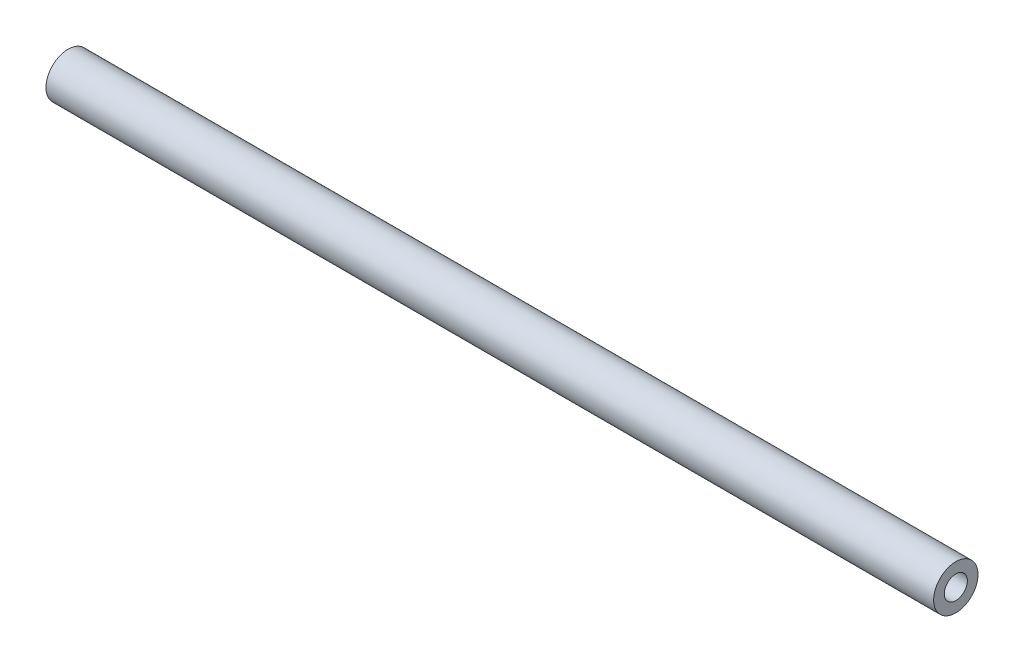
from build123d import *

# Parameters (mm, degrees)
SKETCH3_R           = 6.35
SKETCH3_R_2         = 3.302
BOSS_EXTRUDE1_DEPTH = 127


with BuildPart() as part:
    # Sketch3 → Boss-Extrude1 (new, symmetric)
    with BuildSketch(Plane(origin=(0, 0, 0), x_dir=(0, 0, -1), z_dir=(1, 0, 0))):
        Circle(SKETCH3_R)
        Circle(SKETCH3_R_2, mode=Mode.SUBTRACT)
    extrude(amount=BOSS_EXTRUDE1_DEPTH, both=True)


solid = part.part
